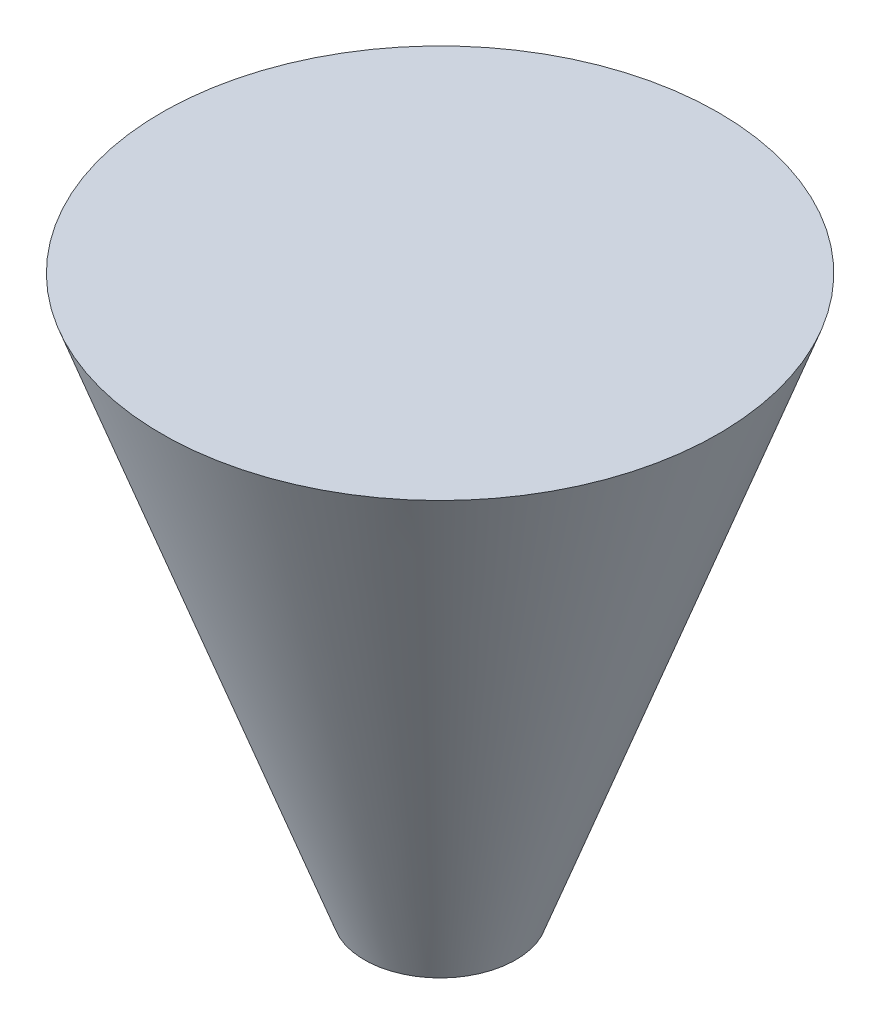
from build123d import *

# Parameters (mm, degrees)
SKETCH1_W           = 203.69051182
SKETCH1_H           = 2
BASE_EXTRUDE_DEPTH  = 60
SKETCH3_R           = 1.5
BOSS_EXTRUDE1_DEPTH = 3
BOSS_EXTRUDE1_TAPER = 20
SKETCH4_W           = 120
SKETCH4_H           = 2
CUT_EXTRUDE1_DEPTH  = 213.364838441


with BuildPart() as part:
    # Sketch1 → Base-Extrude (new, symmetric)
    with BuildSketch(Plane.XY):
        with Locations((0, 1)):
            Rectangle(SKETCH1_W, SKETCH1_H)
    extrude(amount=BASE_EXTRUDE_DEPTH, both=True)

    # Sketch3 → Boss-Extrude1 (add)
    with BuildSketch(Plane.XZ):
        Circle(SKETCH3_R)
    extrude(amount=BOSS_EXTRUDE1_DEPTH, taper=BOSS_EXTRUDE1_TAPER)

    # Sketch4 → Cut-Extrude1 (cut, through all)
    with BuildSketch(Plane(origin=(101.84525591, 0, 0), x_dir=(0, 0, -1), z_dir=(1, 0, 0))):
        with Locations((0, 1)):
            Rectangle(SKETCH4_W, SKETCH4_H)
    extrude(amount=-CUT_EXTRUDE1_DEPTH, mode=Mode.SUBTRACT)


solid = part.part
